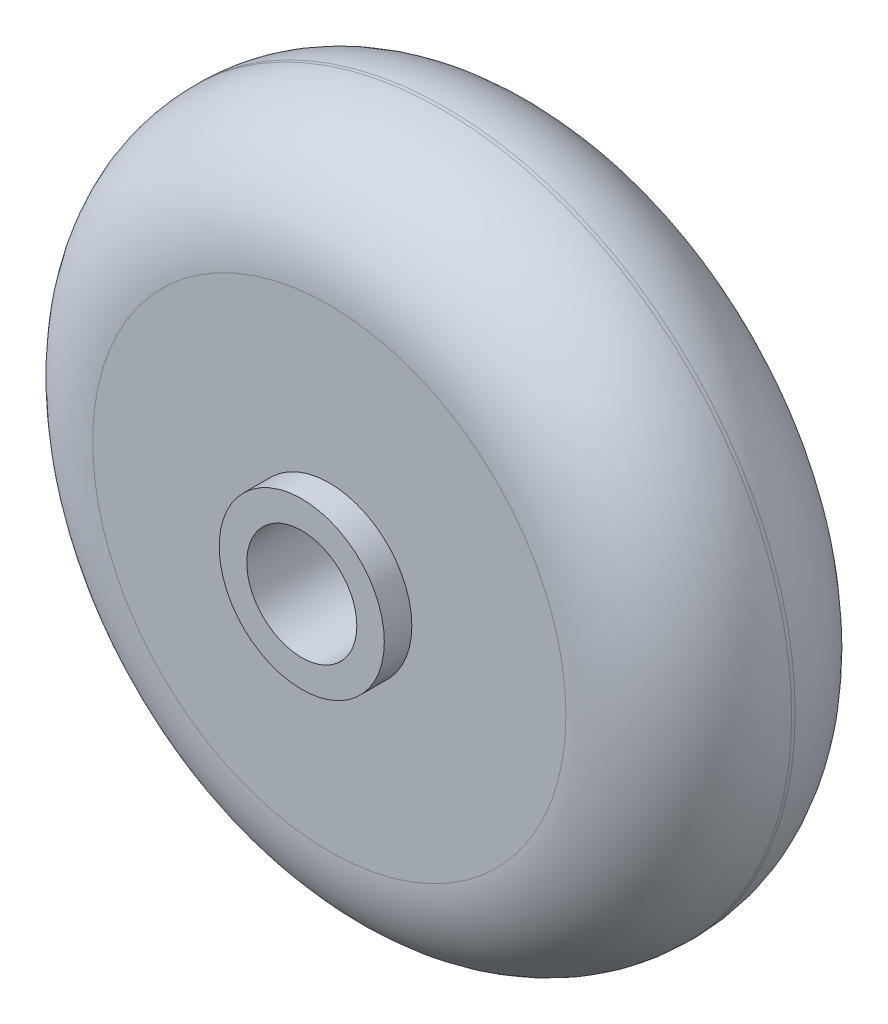
from build123d import *

# Parameters (mm, degrees)
ESQUISSE1_R             = 25.4
ESQUISSE1_R_2           = 4
BOSS_EXTRU_1_DEPTH      = 16.66
BOSS_EXTRU_2_DEPTH      = 2
BOSS_EXTRU_2_DEPTH_BACK = 18.66
ESQUISSE2_R             = 6
ESQUISSE2_R_2           = 4
CONG_1_R                = 8.2


with BuildPart() as part:
    # Esquisse1 → Boss.-Extru.1 (new body)
    with BuildSketch(Plane.XY):
        Circle(ESQUISSE1_R)
        Circle(ESQUISSE1_R_2, mode=Mode.SUBTRACT)
    extrude(amount=BOSS_EXTRU_1_DEPTH)

    # Esquisse2 → Boss.-Extru.2 (add, two sides: drawn at the far end of the back side and taken through both)
    with BuildSketch(Plane.XY.offset(16.66).offset(-BOSS_EXTRU_2_DEPTH_BACK)):
        Circle(ESQUISSE2_R)
        Circle(ESQUISSE2_R_2, mode=Mode.SUBTRACT)
    extrude(amount=BOSS_EXTRU_2_DEPTH + BOSS_EXTRU_2_DEPTH_BACK)

    # Congé1
    cong_1_edges = [part.edges().sort_by_distance(p)[0] for p in [
        (-25.4, 0, 0),
        (-25.4, 0, 16.66),
    ]]
    fillet(cong_1_edges, radius=CONG_1_R)


solid = part.part
